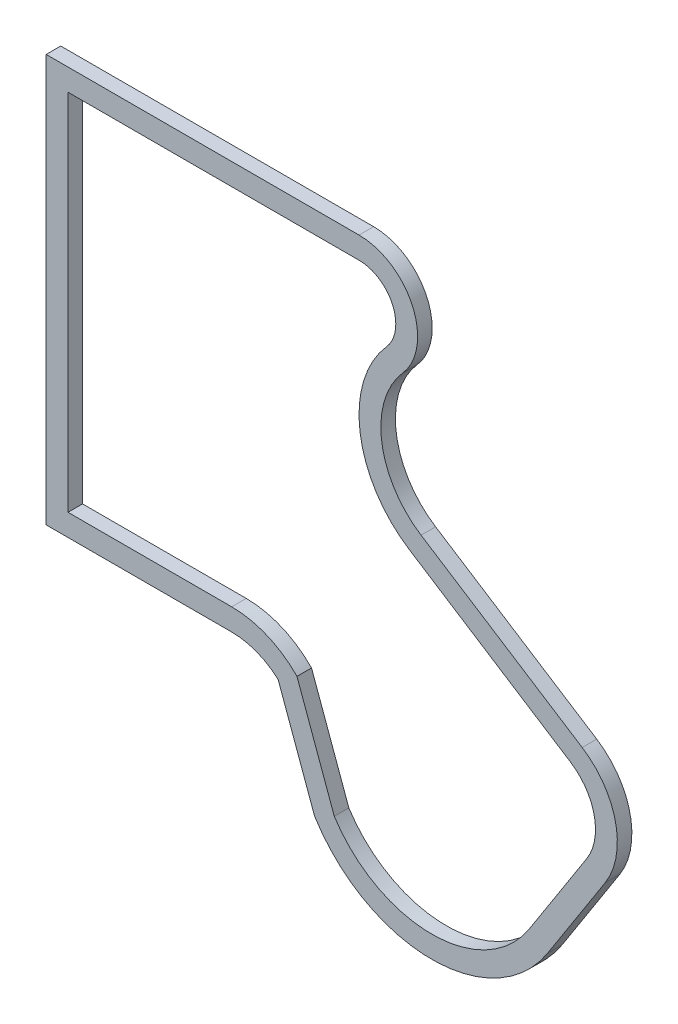
from build123d import *

# Parameters (mm, degrees)
BOSS_EXTRUDE1_DEPTH = 5.08


with BuildPart() as part:
    # Sketch1 → Boss-Extrude1 (new body)
    with BuildSketch(Plane.XY):
        with BuildLine():
            Line((-7.62, -7.62), (-7.62, 134.62))
            Line((-7.62, 134.62), (101.6, 134.62))
            ThreePointArc((101.6, 134.62), (120.252989831, 122.555420822), (116.89921922, 100.595449896))
            ThreePointArc((116.89921922, 100.595449896), (109.507548694, 76.190999841), (123.247106812, 54.709879795))
            Line((123.247106812, 54.709879795), (179.49628154, 18.640745596))
            ThreePointArc((179.49628154, 18.640745596), (191.154782754, 1.885366153), (187.550745596, -18.20628154))
            Line((187.550745596, -18.20628154), (167.450498742, -49.552259826))
            ThreePointArc((167.450498742, -49.552259826), (126.559009674, -71.664336239), (86.0802479, -48.805472603))
            Line((86.0802479, -48.805472603), (73.370195116, -13.884889578))
            ThreePointArc((73.370195116, -13.884889578), (65.844014766, -9.240646228), (57.15, -7.62))
            Line((57.15, -7.62), (-7.62, -7.62))
        make_face()
        with BuildLine():
            Line((0, 0), (0, 127))
            Line((0, 127), (101.6, 127))
            ThreePointArc((101.6, 127), (113.303244129, 119.430451273), (111.199024024, 105.65234368))
            ThreePointArc((111.199024024, 105.65234368), (101.959435867, 75.14678111), (119.133883514, 48.295381054))
            Line((119.133883514, 48.295381054), (175.383058243, 12.226246854))
            ThreePointArc((175.383058243, 12.226246854), (183.71055911, 0.258118681), (181.136246854, -14.093058243))
            Line((181.136246854, -14.093058243), (161.036, -45.439036529))
            ThreePointArc((161.036, -45.439036529), (127, -64.046359823), (92.964, -45.439036529))
            Line((92.964, -45.439036529), (79.933032539, -9.636747677))
            ThreePointArc((79.933032539, -9.636747677), (69.518644605, -2.508263892), (57.15, 0))
            Line((57.15, 0), (0, 0))
        make_face(mode=Mode.SUBTRACT)
    extrude(amount=BOSS_EXTRUDE1_DEPTH)


solid = part.part
